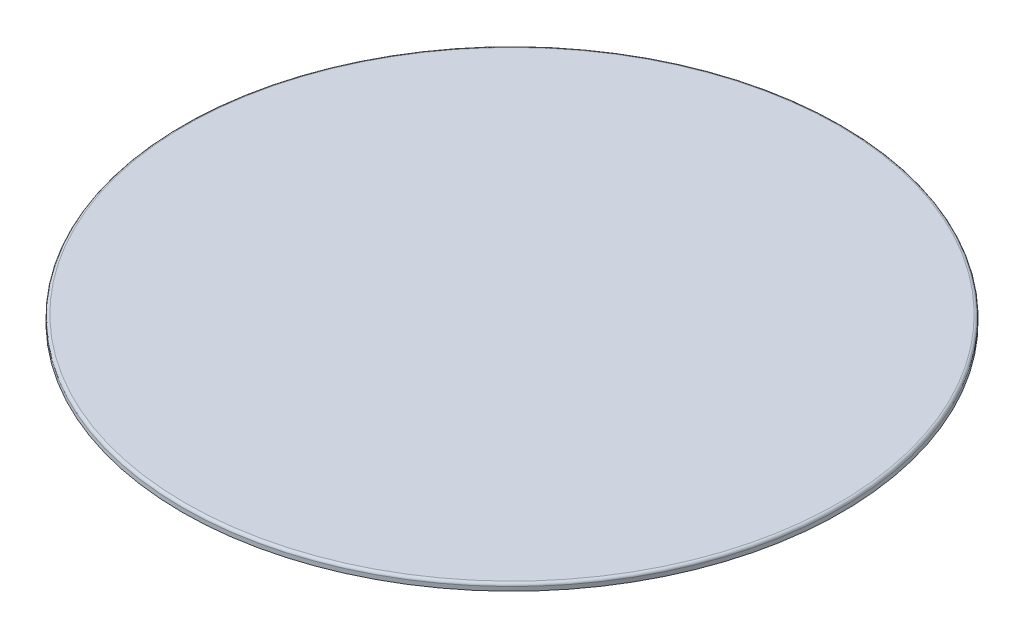
from build123d import *

# Parameters (mm, degrees)
BASES_R      = 24.1
BASE_DEPTH   = 0.5
BASEFILLET_R = 0.2


with BuildPart() as part:
    # BaseS → Base (new body)
    with BuildSketch(Plane(origin=(0, 0, 0), x_dir=(1, 0, 0), z_dir=(0, 1, 0))):
        Circle(BASES_R)
    extrude(amount=BASE_DEPTH)

    # BaseFillet
    basefillet_edges = [part.edges().sort_by_distance(p)[0] for p in [
        (-24.1, 0.5, 0),
    ]]
    fillet(basefillet_edges, radius=BASEFILLET_R)


solid = part.part
